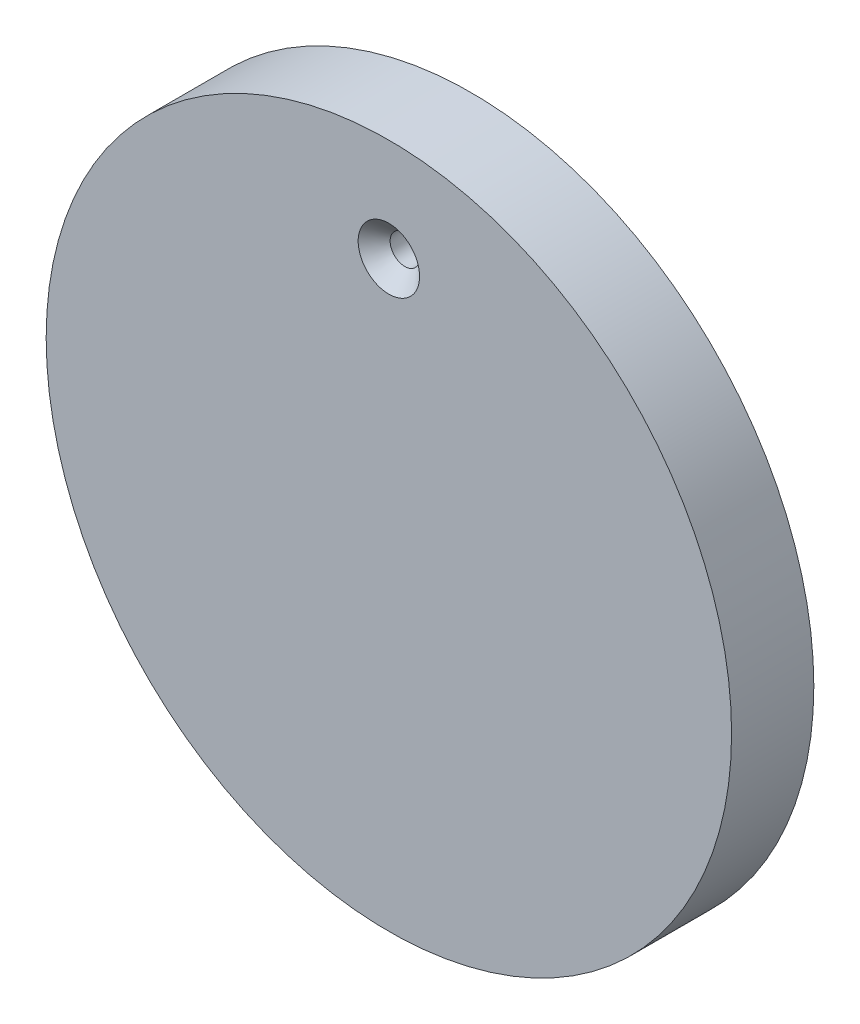
from build123d import *

# Parameters (mm, degrees)
SKETCH2_R                     = 50
BOSS_EXTRUDE1_DEPTH           = 12
CSK_FOR_M4_SFHCS1_D           = 4.3
CSK_FOR_M4_SFHCS1_DEPTH       = 19.5
CSK_FOR_M4_SFHCS1_CSINK_D     = 8.96
CSK_FOR_M4_SFHCS1_CSINK_ANGLE = 90
CSK_FOR_M4_SFHCS1_TIP         = 1.291850331


with BuildPart() as part:
    # Sketch2 → Boss-Extrude1 (new body)
    with BuildSketch(Plane.XY):
        Circle(SKETCH2_R)
    extrude(amount=BOSS_EXTRUDE1_DEPTH)

    # CSK for M4 SFHCS1
    with Locations(Plane(origin=(0, 35, 12), x_dir=(1, 0, 0), z_dir=(0, 0, 1))):
        with Locations((0, 0)):
            CounterSinkHole(CSK_FOR_M4_SFHCS1_D / 2, CSK_FOR_M4_SFHCS1_CSINK_D / 2, depth=CSK_FOR_M4_SFHCS1_DEPTH, counter_sink_angle=CSK_FOR_M4_SFHCS1_CSINK_ANGLE)
            with Locations((0, 0, -(CSK_FOR_M4_SFHCS1_DEPTH + CSK_FOR_M4_SFHCS1_TIP / 2))):  # 118° drill point
                Cone(0, CSK_FOR_M4_SFHCS1_D / 2, CSK_FOR_M4_SFHCS1_TIP, mode=Mode.SUBTRACT)


solid = part.part
